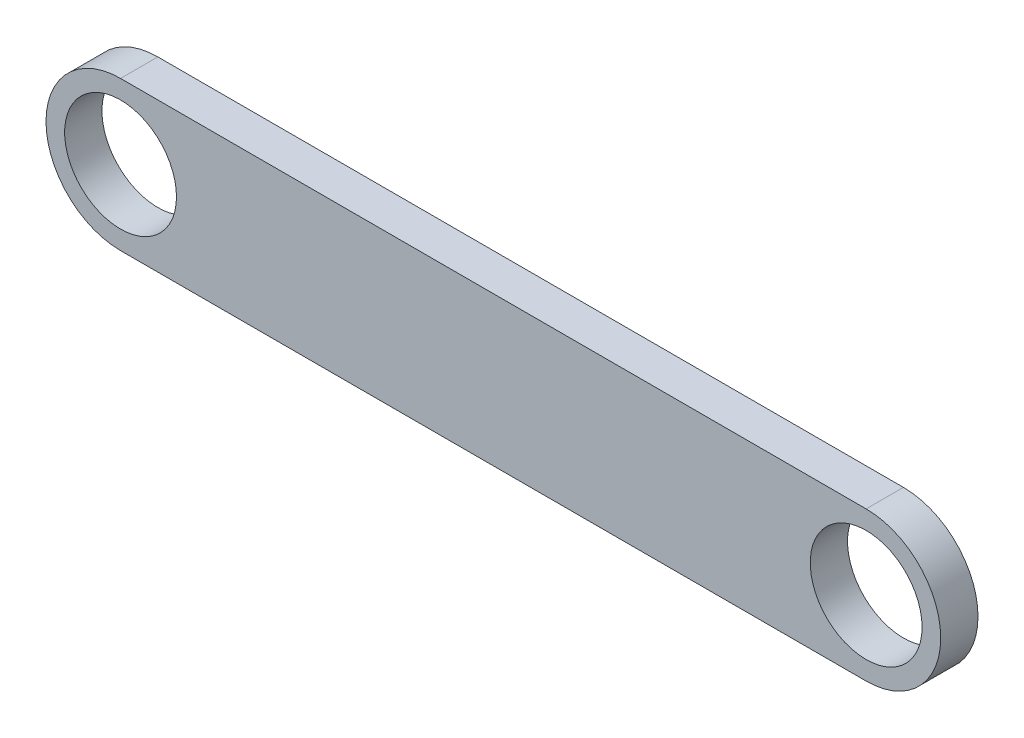
from build123d import *

# Parameters (mm, degrees)
SKETCH1_R           = 1.5
BOSS_EXTRUDE1_DEPTH = 1


with BuildPart() as part:
    # Sketch1 → Boss-Extrude1 (new body)
    with BuildSketch(Plane.XY):
        with BuildLine():
            Line((-25.156652332, 4.261509411), (-5.156652332, 4.261509411))
            ThreePointArc((-5.156652332, 4.261509411), (-3.156652332, 2.261509411), (-5.156652332, 0.261509411))
            Line((-5.156652332, 0.261509411), (-25.156652332, 0.261509411))
            ThreePointArc((-25.156652332, 0.261509411), (-27.156652332, 2.261509411), (-25.156652332, 4.261509411))
        make_face()
        with Locations((-25.156652332, 2.261509411)):
            Circle(SKETCH1_R, mode=Mode.SUBTRACT)
        with Locations((-5.156652332, 2.261509411)):
            Circle(SKETCH1_R, mode=Mode.SUBTRACT)
    extrude(amount=BOSS_EXTRUDE1_DEPTH)


solid = part.part
